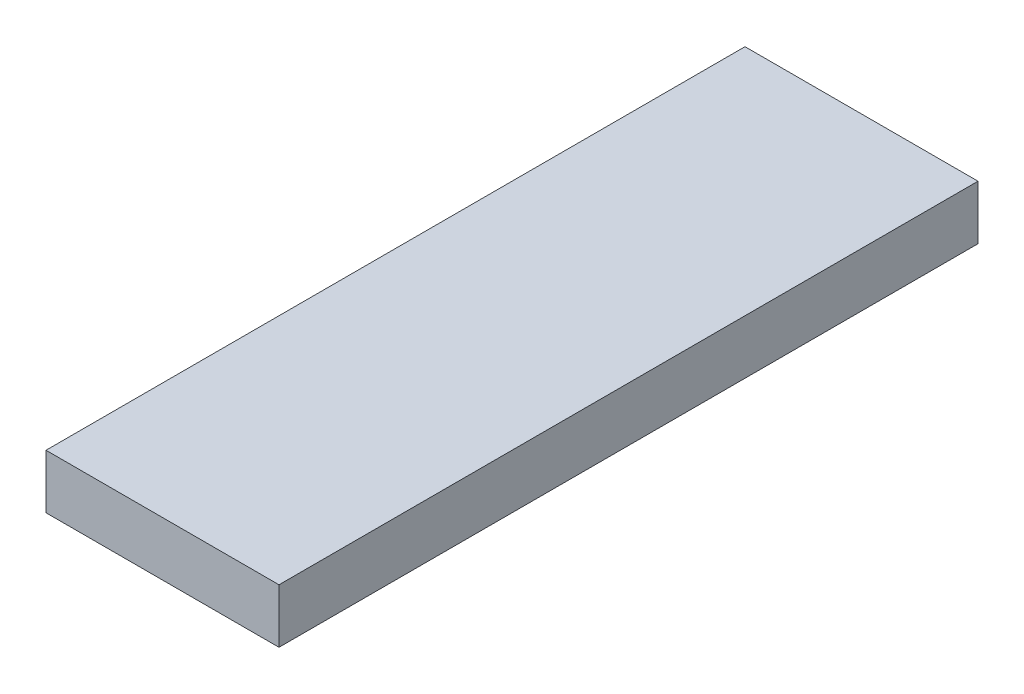
from build123d import *

# Parameters (mm, degrees)
BASE_SKETCH_W       = 50.8
BASE_SKETCH_H       = 152.4
BOSS_EXTRUDE1_DEPTH = 11.81


with BuildPart() as part:
    # Base_Sketch → Boss-Extrude1 (new body)
    with BuildSketch(Plane(origin=(0, 0, 0), x_dir=(1, 0, 0), z_dir=(0, 1, 0))):
        with Locations((-197.898914239, 1218.223107284)):
            Rectangle(BASE_SKETCH_W, BASE_SKETCH_H)
    extrude(amount=BOSS_EXTRUDE1_DEPTH)


solid = part.part
